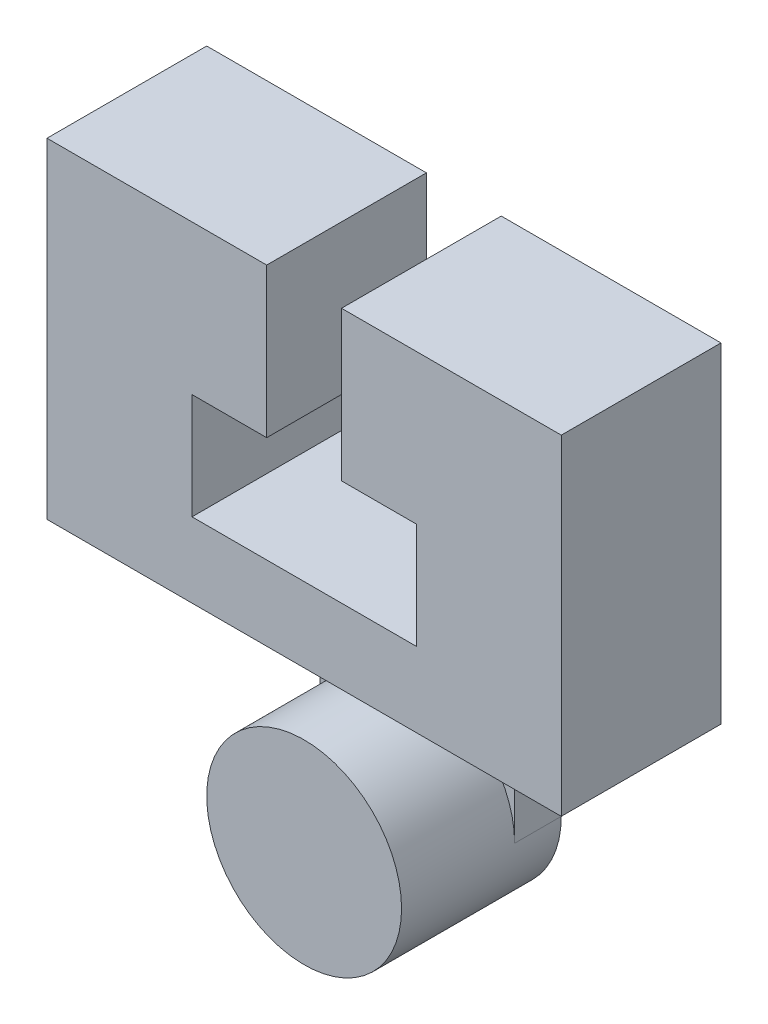
from build123d import *

# Parameters (mm, degrees)
SKETCH1_R           = 15.494
BOSS_EXTRUDE1_DEPTH = 25.4
BOSS_EXTRUDE2_START = -7.4168
BOSS_EXTRUDE2_DEPTH = 7.4168
BOSS_EXTRUDE4_DEPTH = 25.4
CUT_EXTRUDE1_DEPTH  = 92.576032231


with BuildPart() as part:
    # Sketch1 → Boss-Extrude1 (new body)
    with BuildSketch(Plane.XY):
        Circle(SKETCH1_R)
    extrude(amount=-BOSS_EXTRUDE1_DEPTH)

    # Sketch2 → Boss-Extrude2 (add)
    with BuildSketch(Plane(origin=(0, 0, -25.4), x_dir=(-1, 0, 0), z_dir=(0, 0, -1)).offset(BOSS_EXTRUDE2_START)):
        with BuildLine():
            Line((-15.494, 0), (-15.494, 25.4))
            Line((-15.494, 25.4), (15.494, 25.4))
            Line((15.494, 25.4), (15.494, 0))
            ThreePointArc((15.494, 0), (0, 15.494), (-15.494, 0))
        make_face()
    extrude(amount=BOSS_EXTRUDE2_DEPTH)

    # Sketch3 → Boss-Extrude4 (add)
    with BuildSketch(Plane(origin=(0, 0, -25.4), x_dir=(-1, 0, 0), z_dir=(0, 0, -1))):
        Polygon((-15.494, 25.4), (-40.894, 25.4), (-40.894, 77.9018), (40.894, 77.9018), (40.894, 25.4), (15.494, 25.4), align=None)
    extrude(amount=-BOSS_EXTRUDE4_DEPTH)

    # Sketch4 → Cut-Extrude1 (cut, through all)
    with BuildSketch(Plane(origin=(0, 0, -25.4), x_dir=(-1, 0, 0), z_dir=(0, 0, -1))):
        Polygon((-5.94478872, 77.9018), (-5.94478872, 54.1274), (-17.8308, 54.1274), (-17.8308, 37.2872), (17.8308, 37.2872), (17.8308, 54.1274), (5.9554872, 54.1274), (5.9554872, 77.9018), align=None)
    extrude(amount=-CUT_EXTRUDE1_DEPTH, mode=Mode.SUBTRACT)


solid = part.part
